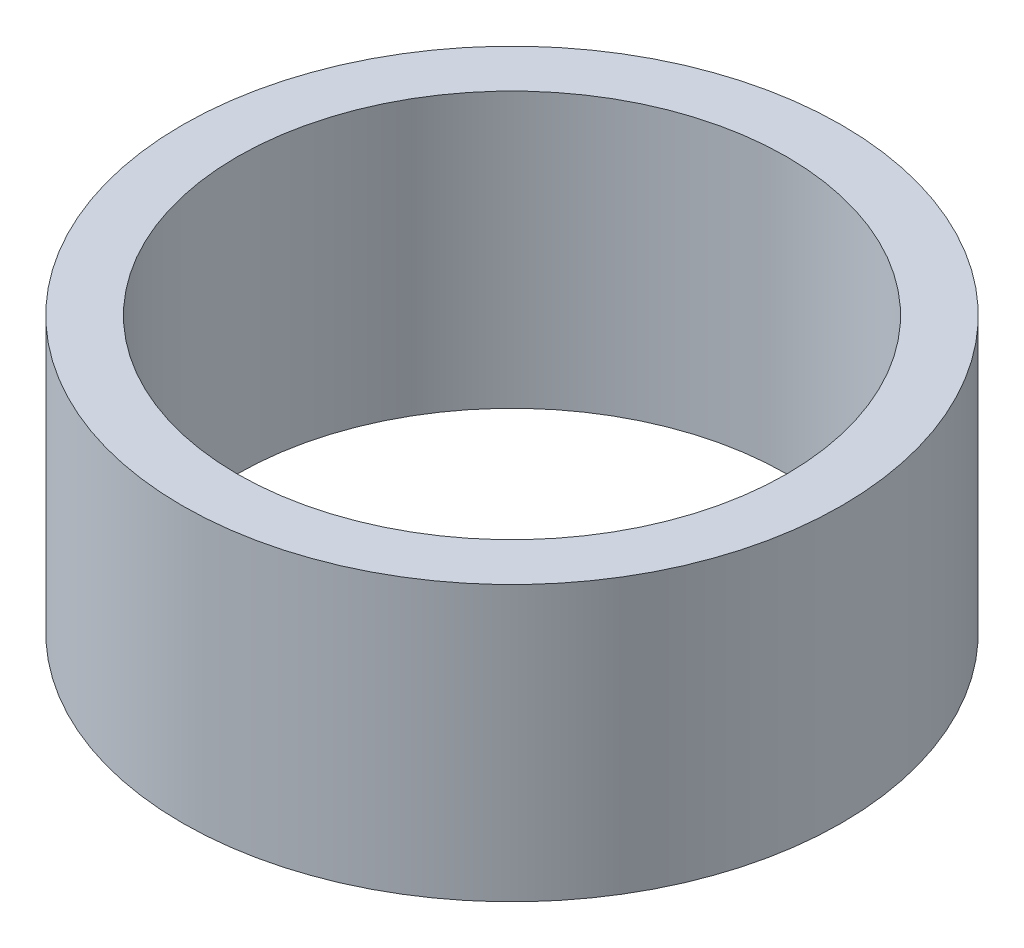
from build123d import *

# Parameters (mm, degrees)
SKETCH_1_R      = 6
SKETCH_1_R_2    = 5
EXTRUDE_1_DEPTH = 5


with BuildPart() as part:
    # 草图1 → 凸台-拉伸1 (new body)
    with BuildSketch(Plane(origin=(0, 0, 0), x_dir=(1, 0, 0), z_dir=(0, 1, 0))):
        with Locations(Location((0, 0, 0), (0, 0, 270))):
            Circle(SKETCH_1_R)
        with Locations(Location((0, 0, 0), (0, 0, 270))):
            Circle(SKETCH_1_R_2, mode=Mode.SUBTRACT)
    extrude(amount=EXTRUDE_1_DEPTH)


solid = part.part
